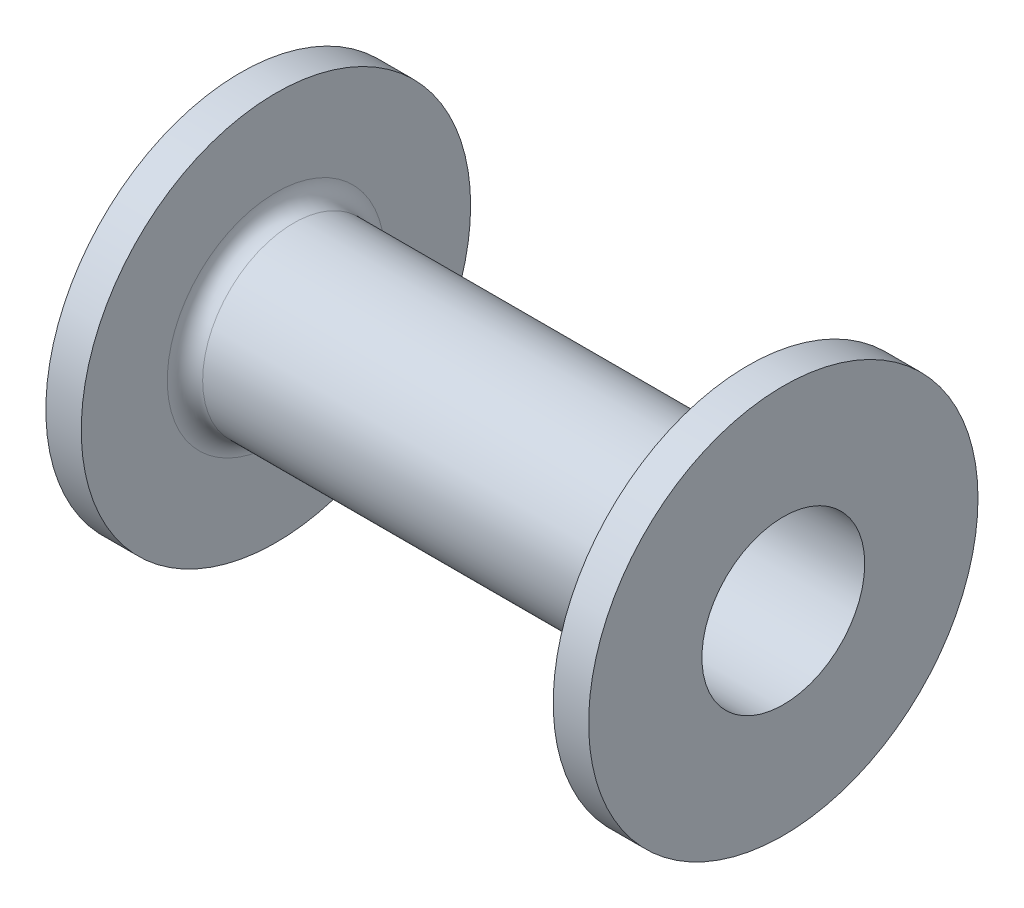
from build123d import *


with BuildPart() as part:
    # Sketch1 → Revolve1 (revolve)
    with BuildSketch(Plane.XY, mode=Mode.PRIVATE) as revolve1_sk:
        with BuildLine():
            Line((0, 6.9), (0, 16.5))
            Line((0, 16.5), (3, 16.5))
            Line((3, 16.5), (3, 9.21))
            ThreePointArc((3, 9.21), (3.439339828, 8.149339828), (4.5, 7.71))
            Line((4.5, 7.71), (41.5, 7.71))
            ThreePointArc((41.5, 7.71), (42.560660172, 8.149339828), (43, 9.21))
            Line((43, 9.21), (43, 16.5))
            Line((43, 16.5), (46, 16.5))
            Line((46, 16.5), (46, 6.9))
            Line((46, 6.9), (43, 6.9))
            Line((43, 6.9), (3, 6.9))
            Line((3, 6.9), (0, 6.9))
        make_face()
    revolve(revolve1_sk.sketch.rotate(Axis((0, 0, 0), (-1, 0, 0)), 90), axis=Axis((0, 0, 0), (-1, 0, 0)))


solid = part.part
